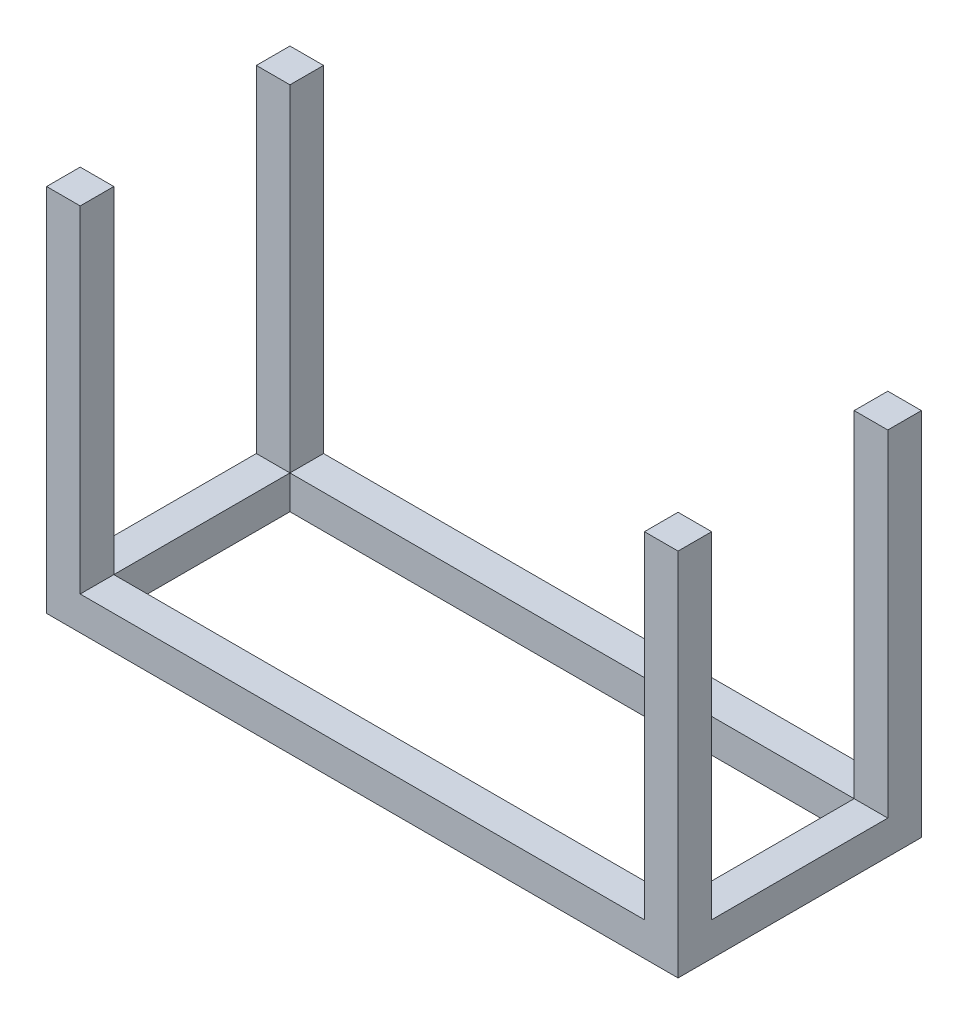
from build123d import *

# Parameters (mm, degrees)
SKETCH1_W           = 140.9
SKETCH1_H           = 54.3
SKETCH1_W_2         = 125.9
SKETCH1_H_2         = 39.3
BOSS_EXTRUDE1_DEPTH = 7.5
SKETCH2_W           = 7.5
SKETCH2_H           = 7.5
BOSS_EXTRUDE2_DEPTH = 75


with BuildPart() as part:
    # Sketch1 → Boss-Extrude1 (new body)
    with BuildSketch(Plane(origin=(0, 0, 0), x_dir=(1, 0, 0), z_dir=(0, 1, 0))):
        Rectangle(SKETCH1_W, SKETCH1_H)
        Rectangle(SKETCH1_W_2, SKETCH1_H_2, mode=Mode.SUBTRACT)
    extrude(amount=BOSS_EXTRUDE1_DEPTH)

    # Sketch2 → Boss-Extrude2 (add)
    with BuildSketch(Plane(origin=(0, 7.5, 0), x_dir=(1, 0, 0), z_dir=(0, 1, 0))):
        with Locations((-66.7, 23.4)):
            Rectangle(SKETCH2_W, SKETCH2_H)
        with Locations((66.7, 23.4)):
            Rectangle(SKETCH2_W, SKETCH2_H)
        with Locations((66.7, -23.4)):
            Rectangle(SKETCH2_W, SKETCH2_H)
        with Locations((-66.7, -23.4)):
            Rectangle(SKETCH2_W, SKETCH2_H)
    extrude(amount=BOSS_EXTRUDE2_DEPTH)


solid = part.part
